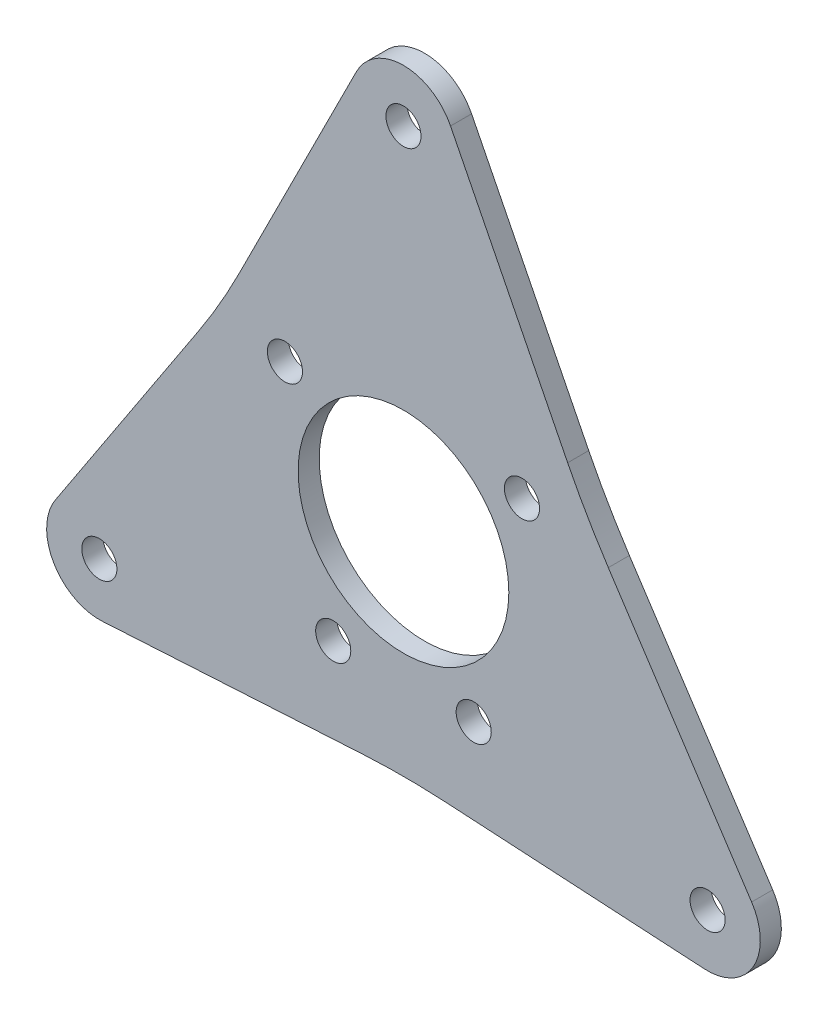
from build123d import *

# Parameters (mm, degrees)
SKETCH1_R           = 5
SKETCH1_R_2         = 30
BOSS_EXTRUDE1_DEPTH = 6


with BuildPart() as part:
    # Sketch1 → Boss-Extrude1 (new body)
    with BuildSketch(Plane.XY):
        with BuildLine():
            Line((-99.136639798, -41.760075744), (-58.33663034, 20.302554811))
            ThreePointArc((-58.33663034, 20.302554811), (-52.252875179, 30.168211551), (-46.750843398, 40.36972644))
            Line((-46.750843398, 40.36972644), (-13.40303344, 106.734886383))
            ThreePointArc((-13.40303344, 106.734886383), (0, 115), (13.40303344, 106.734886383))
            Line((13.40303344, 106.734886383), (46.750843398, 40.36972644))
            ThreePointArc((46.750843398, 40.36972644), (52.252875179, 30.168211551), (58.33663034, 20.302554811))
            Line((58.33663034, 20.302554811), (99.136639798, -41.760075744))
            ThreePointArc((99.136639798, -41.760075744), (99.592921435, -57.5), (85.733606358, -64.974810639))
            Line((85.733606358, -64.974810639), (11.585786942, -60.672281251))
            ThreePointArc((11.585786942, -60.672281251), (0, -60.336423102), (-11.585786942, -60.672281251))
            Line((-11.585786942, -60.672281251), (-85.733606358, -64.974810639))
            ThreePointArc((-85.733606358, -64.974810639), (-99.592921435, -57.5), (-99.136639798, -41.760075744))
        make_face()
        with Locations((0, 100)):
            Circle(SKETCH1_R, mode=Mode.SUBTRACT)
        with Locations((86.602540378, -50)):
            Circle(SKETCH1_R, mode=Mode.SUBTRACT)
        with Locations((-86.602540378, -50)):
            Circle(SKETCH1_R, mode=Mode.SUBTRACT)
        Circle(SKETCH1_R_2, mode=Mode.SUBTRACT)
        with Locations((-33.75, 25.061076609)):
            Circle(SKETCH1_R, mode=Mode.SUBTRACT)
        with Locations((33.75, 25.061076609)):
            Circle(SKETCH1_R, mode=Mode.SUBTRACT)
        with Locations((-20, -36.932370625)):
            Circle(SKETCH1_R, mode=Mode.SUBTRACT)
        with Locations((20, -36.932370625)):
            Circle(SKETCH1_R, mode=Mode.SUBTRACT)
    extrude(amount=BOSS_EXTRUDE1_DEPTH)


solid = part.part
